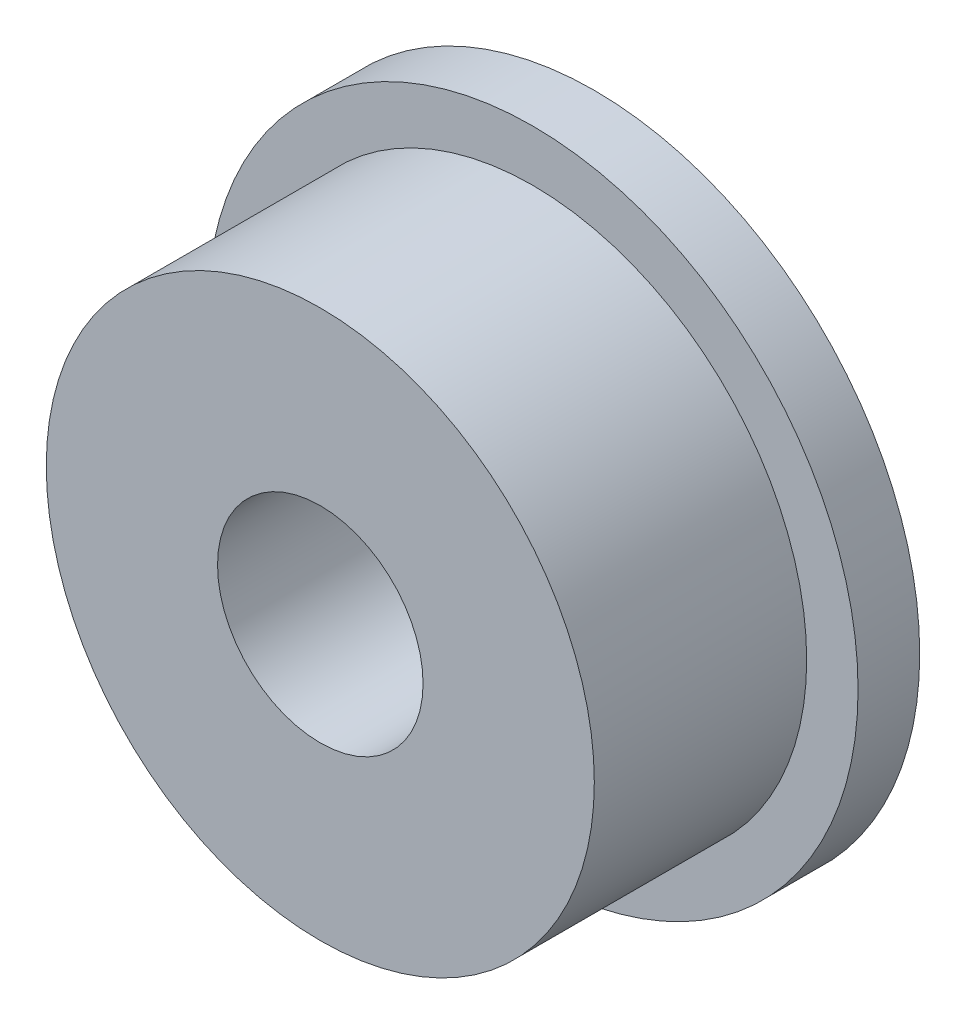
from build123d import *

# Parameters (mm, degrees)
F693ZZ_EXTERNAL_ENVELOPE_3X8X4_START = -3
SKETCH1_R                            = 4
SKETCH1_R_2                          = 1.5
F693ZZ_EXTERNAL_ENVELOPE_3X8X4_DEPTH = 4
FLANGE_9P5X0P9_START                 = -3
SKETCH2_R                            = 4.75
SKETCH2_R_2                          = 1.5
FLANGE_9P5X0P9_DEPTH                 = 0.9


with BuildPart() as part:
    # Sketch1 → F693ZZ_External_Envelope_3x8x4 (new body)
    with BuildSketch(Plane.XY.offset(F693ZZ_EXTERNAL_ENVELOPE_3X8X4_START)):
        Circle(SKETCH1_R)
        Circle(SKETCH1_R_2, mode=Mode.SUBTRACT)
    extrude(amount=F693ZZ_EXTERNAL_ENVELOPE_3X8X4_DEPTH)

    # Sketch2 → Flange_9p5x0p9 (add)
    with BuildSketch(Plane.XY.offset(FLANGE_9P5X0P9_START)):
        Circle(SKETCH2_R)
        Circle(SKETCH2_R_2, mode=Mode.SUBTRACT)
    extrude(amount=FLANGE_9P5X0P9_DEPTH)


solid = part.part
